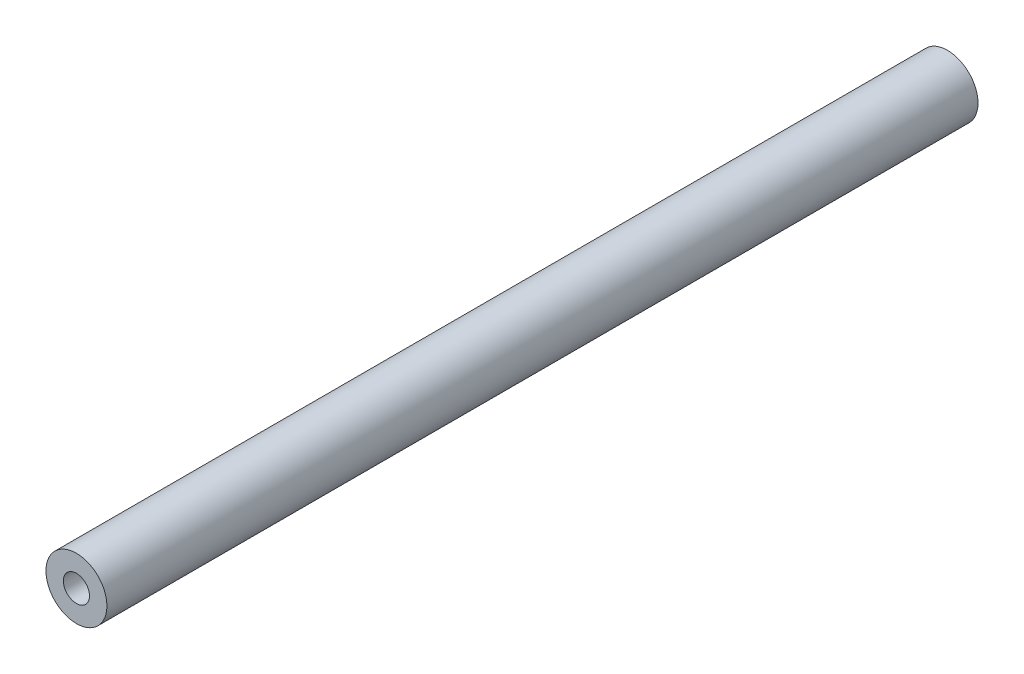
from build123d import *

# Parameters (mm, degrees)
SKETCH1_R           = 3.5
SKETCH1_R_2         = 1.5
BOSS_EXTRUDE1_DEPTH = 100


with BuildPart() as part:
    # Sketch1 → Boss-Extrude1 (new body)
    with BuildSketch(Plane.XY):
        Circle(SKETCH1_R)
        Circle(SKETCH1_R_2, mode=Mode.SUBTRACT)
    extrude(amount=BOSS_EXTRUDE1_DEPTH)


solid = part.part
